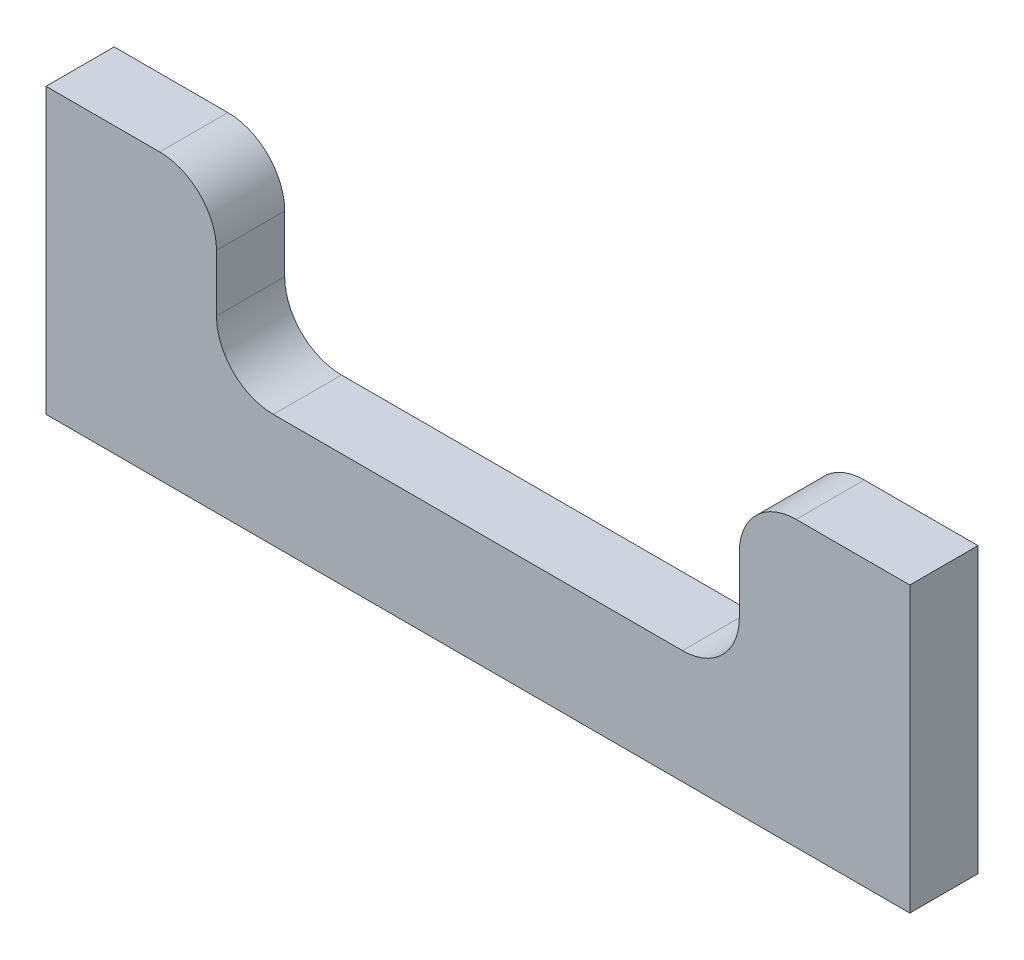
from build123d import *

# Parameters (mm, degrees)
EXTRUDE_1_DEPTH = 6
FILLET_1_R      = 5


with BuildPart() as part:
    # ｽｹｯﾁ1 → ﾎﾞｽ - 押し出し1 (new body)
    with BuildSketch(Plane.XY):
        Polygon((-38, 0), (38, 0), (38, 25), (23, 25), (23, 10), (-23, 10), (-23, 25), (-38, 25), align=None)
    extrude(amount=EXTRUDE_1_DEPTH)

    # ﾌｨﾚｯﾄ1
    fillet_1_edges = [part.edges().sort_by_distance(p)[0] for p in [
        (23, 25, 3),
        (-23, 25, 3),
        (-23, 10, 3),
        (23, 10, 3),
    ]]
    fillet(fillet_1_edges, radius=FILLET_1_R)


solid = part.part
